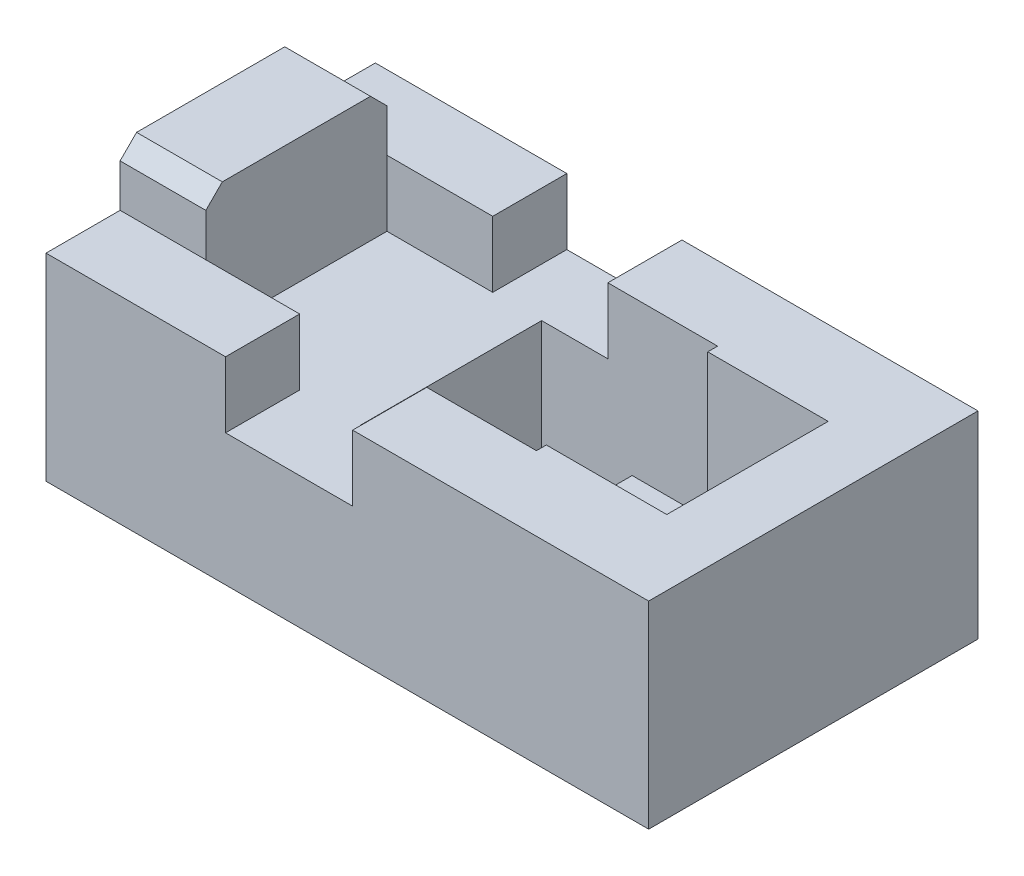
from build123d import *

# Parameters (mm, degrees)
SKETCH1_W           = 19.5
SKETCH1_H           = 10
BOSS_EXTRUDE1_DEPTH = 4
SKETCH2_W           = 9
SKETCH2_H           = 5.5
CUT_EXTRUDE1_DEPTH  = 2.7
SKETCH3_W           = 3.2
SKETCH3_H           = 3.9
CUT_EXTRUDE2_DEPTH  = 12.664583147
SKETCH4_W           = 1.747901038
SKETCH4_H           = 5.5
CUT_EXTRUDE3_DEPTH  = 12.285056491
CHAMFER2_SIZE       = 1
SKETCH5_W           = 10
SKETCH5_H           = 4
BOSS_EXTRUDE2_DEPTH = 2
SKETCH6_W           = 1.747077863
SKETCH6_H           = 5.5
BOSS_EXTRUDE3_DEPTH = 1.5
BOSS_EXTRUDE4_DEPTH = 2
BOSS_EXTRUDE5_REACH = 16.109
SKETCH9_W           = 3.657403566
SKETCH9_H           = 0.3
SKETCH10_W          = 5.81497097
SKETCH10_H          = 2.25
SKETCH10_W_2        = 5.452409629
BOSS_EXTRUDE6_DEPTH = 2
SKETCH11_W          = 2.603359148
SKETCH11_H          = 5.5
BOSS_EXTRUDE7_DEPTH = 3.8
CHAMFER3_SIZE       = 0.5
SKETCH12_W          = 10
SKETCH12_H          = 6
CUT_EXTRUDE4_DEPTH  = 3.8


with BuildPart() as part:
    # Sketch1 → Boss-Extrude1 (new body)
    with BuildSketch(Plane(origin=(0, 0, 0), x_dir=(1, 0, 0), z_dir=(0, 1, 0))):
        Rectangle(SKETCH1_W, SKETCH1_H)
    extrude(amount=BOSS_EXTRUDE1_DEPTH)

    # Sketch2 → Cut-Extrude1 (cut)
    with BuildSketch(Plane(origin=(0, 4, 0), x_dir=(1, 0, 0), z_dir=(0, 1, 0))):
        with Locations((5.25, 0)):
            Rectangle(SKETCH2_W, SKETCH2_H)
    extrude(amount=-CUT_EXTRUDE1_DEPTH, mode=Mode.SUBTRACT)

    # Sketch3 → Cut-Extrude2 (cut, through all)
    with BuildSketch(Plane(origin=(0, 4, 0), x_dir=(1, 0, 0), z_dir=(0, 1, 0))):
        with Locations((-8.15, 3.05)):
            Rectangle(SKETCH3_W, SKETCH3_H)
        with Locations((-8.15, -3.05)):
            Rectangle(SKETCH3_W, SKETCH3_H)
    extrude(amount=-CUT_EXTRUDE2_DEPTH, mode=Mode.SUBTRACT)

    # Sketch4 → Cut-Extrude3 (cut, through all)
    with BuildSketch(Plane(origin=(0, 1.3, 0), x_dir=(1, 0, 0), z_dir=(0, 1, 0))):
        with Locations((1.623950519, 0)):
            Rectangle(SKETCH4_W, SKETCH4_H)
    extrude(amount=-CUT_EXTRUDE3_DEPTH, mode=Mode.SUBTRACT)

    # Chamfer2
    chamfer2_edges = [part.edges().sort_by_distance(p)[0] for p in [
        (2.497901038, 1.3, 0),
    ]]
    chamfer(chamfer2_edges, length=CHAMFER2_SIZE)

    # Sketch5 → Boss-Extrude2 (add)
    with BuildSketch(Plane(origin=(9.75, 0, 0), x_dir=(0, 0, -1), z_dir=(1, 0, 0))):
        with Locations((0, 2)):
            Rectangle(SKETCH5_W, SKETCH5_H)
    extrude(amount=BOSS_EXTRUDE2_DEPTH)

    # Sketch6 → Boss-Extrude3 (add)
    with BuildSketch(Plane(origin=(0, 1.3, 0), x_dir=(1, 0, 0), z_dir=(0, 1, 0))):
        with Locations((8.876461068, 0)):
            Rectangle(SKETCH6_W, SKETCH6_H)
    extrude(amount=BOSS_EXTRUDE3_DEPTH)

    # Sketch7 → Boss-Extrude4 (add)
    with BuildSketch(Plane(origin=(0, 4, 0), x_dir=(1, 0, 0), z_dir=(0, 1, 0))):
        Polygon((2.760699465, 2.75), (2.760699465, 5), (11.75, 5), (11.75, -5), (2.760699465, -5), (2.760699465, -2.75), (9.75, -2.75), (9.75, 2.75), align=None)
    extrude(amount=BOSS_EXTRUDE4_DEPTH)

    # Sketch9 → Boss-Extrude5 (add, up to next)
    with BuildSketch(Plane(origin=(0, 6, 0), x_dir=(1, 0, 0), z_dir=(0, 1, 0)), mode=Mode.PRIVATE) as boss_extrude5_sk1:
        with Locations((7.921298217, 2.6)):
            Rectangle(SKETCH9_W, SKETCH9_H)
    boss_extrude5_tool1 = extrude(boss_extrude5_sk1.sketch, amount=-BOSS_EXTRUDE5_REACH, mode=Mode.PRIVATE) - part.part
    # Sketch9 → Boss-Extrude5 (add, up to next)
    with BuildSketch(Plane(origin=(0, 6, 0), x_dir=(1, 0, 0), z_dir=(0, 1, 0)), mode=Mode.PRIVATE) as boss_extrude5_sk2:
        with Locations((7.921298217, -2.6)):
            Rectangle(SKETCH9_W, SKETCH9_H)
    boss_extrude5_tool2 = extrude(boss_extrude5_sk2.sketch, amount=-BOSS_EXTRUDE5_REACH, mode=Mode.PRIVATE) - part.part
    add(boss_extrude5_tool1.solids().sort_by_distance((7.921298, 6, -2.6))[0])
    add(boss_extrude5_tool2.solids().sort_by_distance((7.921298, 6, 2.6))[0])

    # Sketch10 → Boss-Extrude6 (add)
    with BuildSketch(Plane(origin=(0, 4, 0), x_dir=(1, 0, 0), z_dir=(0, 1, 0))):
        with Locations((-3.642514515, 3.875)):
            Rectangle(SKETCH10_W, SKETCH10_H)
        with Locations((-3.823795186, -3.875)):
            Rectangle(SKETCH10_W_2, SKETCH10_H)
    extrude(amount=BOSS_EXTRUDE6_DEPTH)

    # Sketch11 → Boss-Extrude7 (add)
    with BuildSketch(Plane(origin=(0, 4, 0), x_dir=(1, 0, 0), z_dir=(0, 1, 0))):
        with Locations((-5.248320426, 0)):
            Rectangle(SKETCH11_W, SKETCH11_H)
    extrude(amount=BOSS_EXTRUDE7_DEPTH)

    # Chamfer3
    chamfer3_edges = [part.edges().sort_by_distance(p)[0] for p in [
        (-5.248320426, 7.8, 2.75),
        (-5.248320426, 7.8, -2.75),
    ]]
    chamfer(chamfer3_edges, length=CHAMFER3_SIZE)

    # Sketch12 → Cut-Extrude4 (cut)
    with BuildSketch(Plane.ZY.offset(6.55)):
        with Locations((0, 3)):
            Rectangle(SKETCH12_W, SKETCH12_H)
    extrude(amount=CUT_EXTRUDE4_DEPTH, mode=Mode.SUBTRACT)


solid = part.part
